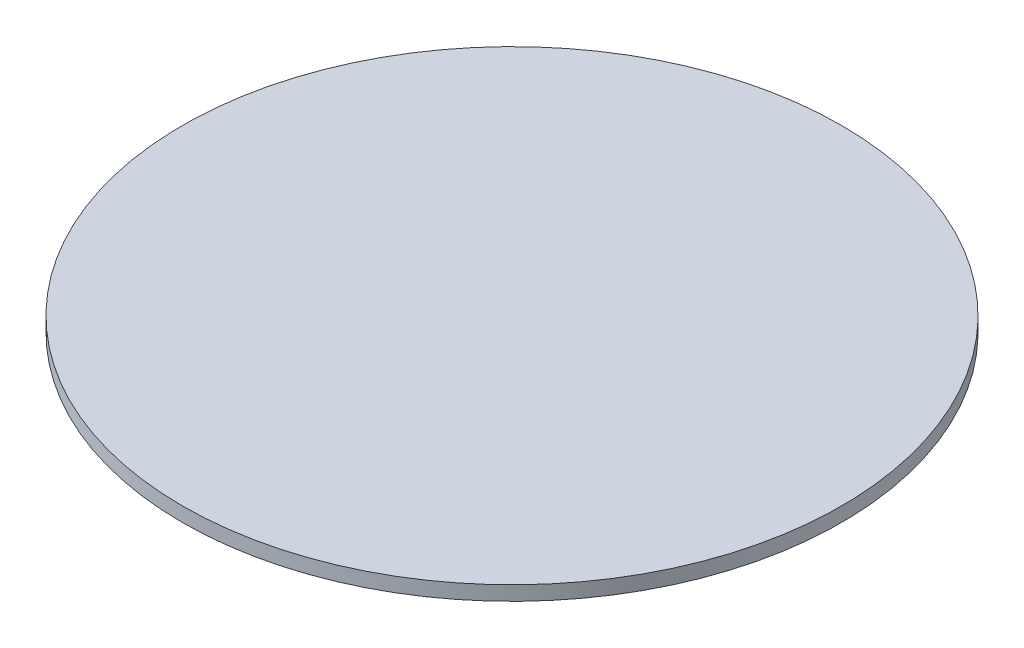
from build123d import *

# Parameters (mm, degrees)
SKETCH2_R           = 58.205669996
BOSS_EXTRUDE1_DEPTH = 2.54


with BuildPart() as part:
    # Sketch2 → Boss-Extrude1 (new body)
    with BuildSketch(Plane(origin=(0, 0, 0), x_dir=(1, 0, 0), z_dir=(0, 1, 0))):
        with Locations(Location((0, 0, 0), (0, 0, 270))):
            Circle(SKETCH2_R)
    extrude(amount=BOSS_EXTRUDE1_DEPTH)


solid = part.part
